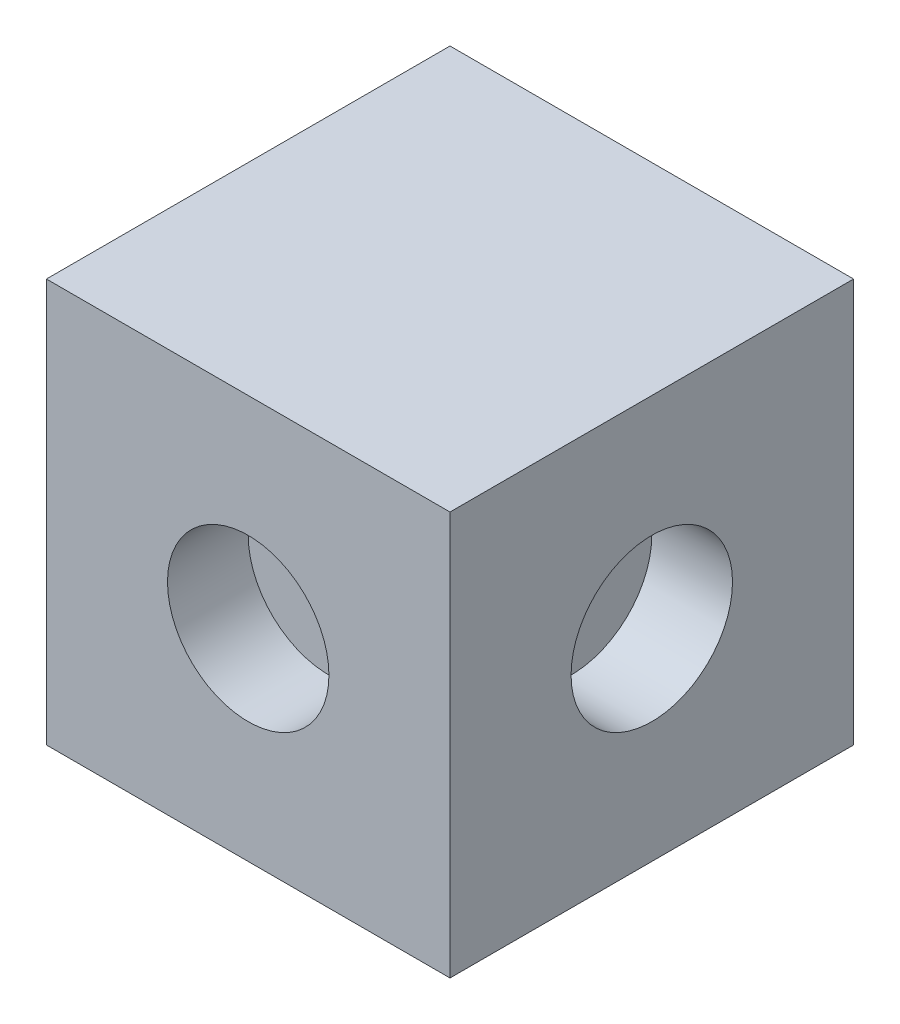
from build123d import *

# Parameters (mm, degrees)
CROQUIS1_W              = 50
CROQUIS1_H              = 50
SALIENTE_EXTRUIR1_DEPTH = 25
CROQUIS2_R              = 10
CORTAR_EXTRUIR3_DEPTH   = 10
CROQUIS4_R              = 10
CORTAR_EXTRUIR4_DEPTH   = 10
CORTAR_EXTRUIR5_START   = -10
CROQUIS5_R              = 10
CORTAR_EXTRUIR5_DEPTH   = 10
CORTAR_EXTRUIR6_START   = -10
CROQUIS6_R              = 10
CORTAR_EXTRUIR6_DEPTH   = 10


with BuildPart() as part:
    # Croquis1 → Saliente-Extruir1 (new, symmetric)
    with BuildSketch(Plane.XY):
        Rectangle(CROQUIS1_W, CROQUIS1_H)
    extrude(amount=SALIENTE_EXTRUIR1_DEPTH, both=True)

    # Croquis2 → Cortar-Extruir3 (cut)
    with BuildSketch(Plane.XY.offset(25)):
        Circle(CROQUIS2_R)
    extrude(amount=-CORTAR_EXTRUIR3_DEPTH, mode=Mode.SUBTRACT)

    # Croquis4 → Cortar-Extruir4 (cut)
    with BuildSketch(Plane(origin=(25, 0, 0), x_dir=(0, 0, -1), z_dir=(1, 0, 0))):
        Circle(CROQUIS4_R)
    extrude(amount=-CORTAR_EXTRUIR4_DEPTH, mode=Mode.SUBTRACT)

    # Croquis5 → Cortar-Extruir5 (cut)
    with BuildSketch(Plane(origin=(0, 0, -25), x_dir=(-1, 0, 0), z_dir=(0, 0, -1)).offset(CORTAR_EXTRUIR5_START)):
        with Locations(Location((0, 0, 0), (0, 0, 180))):
            Circle(CROQUIS5_R)
    extrude(amount=CORTAR_EXTRUIR5_DEPTH, mode=Mode.SUBTRACT)

    # Croquis6 → Cortar-Extruir6 (cut)
    with BuildSketch(Plane.ZY.offset(25).offset(CORTAR_EXTRUIR6_START)):
        with Locations(Location((0, 0, 0), (0, 0, 180))):
            Circle(CROQUIS6_R)
    extrude(amount=CORTAR_EXTRUIR6_DEPTH, mode=Mode.SUBTRACT)


solid = part.part
